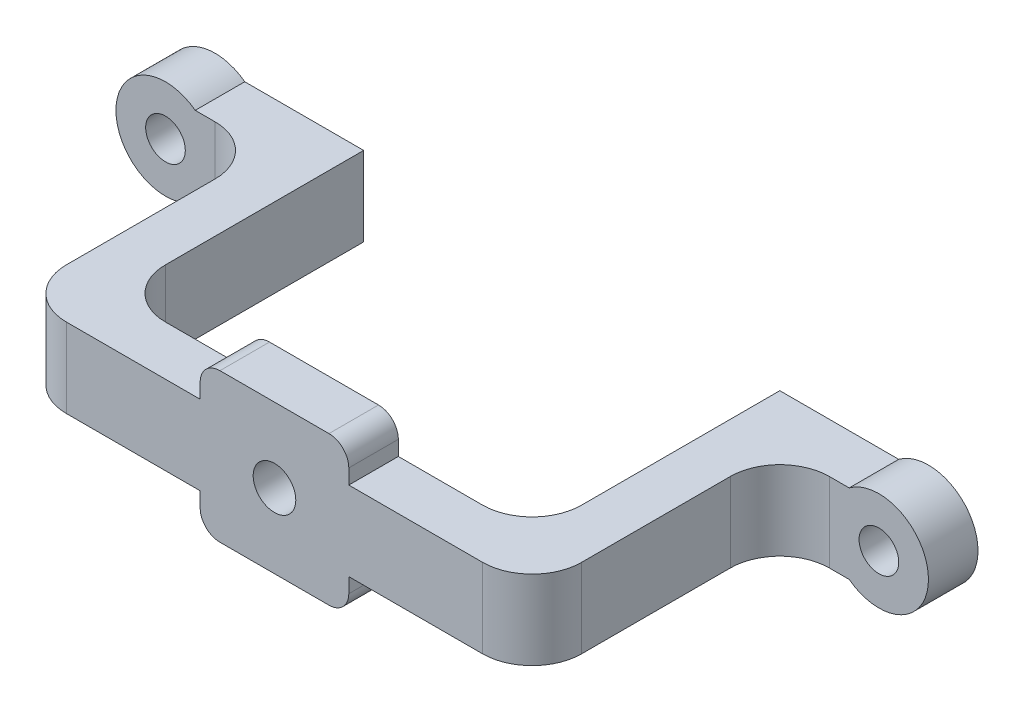
from build123d import *

# Parameters (mm, degrees)
SKETCH_1_R          = 5
EXTRUDE_1_DEPTH     = 5
SKETCH_3_W          = 5
SKETCH_3_H          = 8
EXTRUDE_2_DEPTH     = 15
SKETCH_2_R          = 2
CUT_EXTRUDE_1_DEPTH = 30
SKETCH_6_W          = 5
SKETCH_6_H          = 8
EXTRUDE_4_DEPTH     = 25
SKETCH_7_W          = 5
SKETCH_7_H          = 8
EXTRUDE_5_DEPTH     = 21
SKETCH_8_W          = 15
SKETCH_8_H          = 15
EXTRUDE_6_DEPTH     = 5
FILLET_2_R          = 2
SKETCH_9_R          = 2.15
CUT_EXTRUDE_2_DEPTH = 10
FILLET_3_R          = 5


with BuildPart() as part:
    # 草图1 → 凸台-拉伸1 (new body)
    with BuildSketch(Plane.XY):
        Circle(SKETCH_1_R)
    extrude(amount=EXTRUDE_1_DEPTH)

    # 草图3 → 凸台-拉伸2 (add)
    with BuildSketch(Plane(origin=(0, 0, 0), x_dir=(0, 0, -1), z_dir=(1, 0, 0))):
        with Locations((-2.5, 0)):
            Rectangle(SKETCH_3_W, SKETCH_3_H)
    extrude(amount=EXTRUDE_2_DEPTH)

    # 草图2 → 切除-拉伸1 (cut)
    with BuildSketch(Plane.XY.offset(5)):
        Circle(SKETCH_2_R)
    extrude(amount=-CUT_EXTRUDE_1_DEPTH, mode=Mode.SUBTRACT)

    # 草图6 → 凸台-拉伸4 (add)
    with BuildSketch(Plane.XY.offset(5)):
        with Locations((12.5, 0)):
            Rectangle(SKETCH_6_W, SKETCH_6_H)
    extrude(amount=EXTRUDE_4_DEPTH)

    # 草图7 → 凸台-拉伸5 (add)
    with BuildSketch(Plane(origin=(15, 0, 0), x_dir=(0, 0, -1), z_dir=(1, 0, 0))):
        with Locations((-27.5, 0)):
            Rectangle(SKETCH_7_W, SKETCH_7_H)
    extrude(amount=EXTRUDE_5_DEPTH)

    # 镜向2: part across plane


with BuildPart() as part_1:
    add(part.part)
    add(part.part.mirror(Plane(origin=(36, 0, 0), x_dir=(0, 0, 1), z_dir=(1, 0, 0))))

    # 草图8 → 凸台-拉伸6 (add)
    with BuildSketch(Plane.XY.offset(30)):
        with Locations((36, 0)):
            Rectangle(SKETCH_8_W, SKETCH_8_H)
    extrude(amount=-EXTRUDE_6_DEPTH)

    # 圆角2
    fillet_2_edges = [part_1.edges().sort_by_distance(p)[0] for p in [
        (28.5, -7.5, 27.5),
        (43.5, 7.5, 27.5),
        (28.5, 7.5, 27.5),
        (43.5, -7.5, 27.5),
    ]]
    fillet(fillet_2_edges, radius=FILLET_2_R)

    # 草图9 → 切除-拉伸2 (cut)
    with BuildSketch(Plane.XY.offset(30)):
        with Locations((36, 0)):
            Circle(SKETCH_9_R)
    extrude(amount=-CUT_EXTRUDE_2_DEPTH, mode=Mode.SUBTRACT)

    # 圆角3
    fillet_3_edges = [part_1.edges().sort_by_distance(p)[0] for p in [
        (10, 0, 5),
        (10, 0, 30),
        (15, 0, 25),
        (57, 0, 25),
        (62, 0, 5),
        (62, 0, 30),
    ]]
    fillet(fillet_3_edges, radius=FILLET_3_R)


solid = part_1.part
